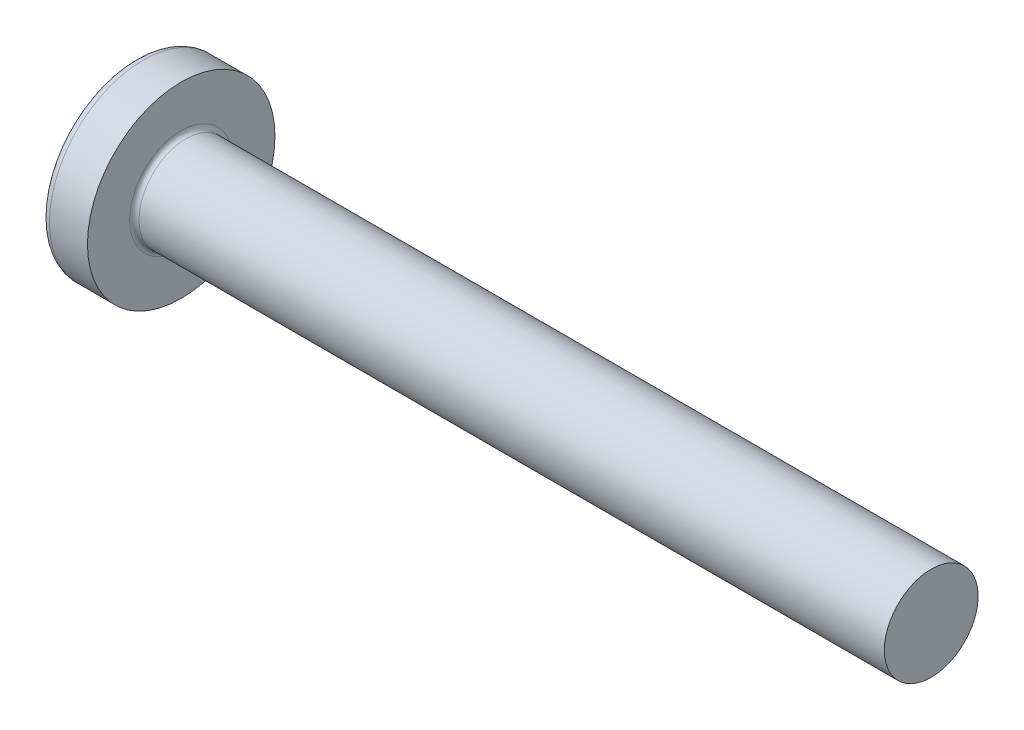
from build123d import *

# Parameters (mm, degrees)
FILLET1_R    = 0.1
RECPAT_COUNT = 2
RECPAT_ANGLE = 90


with BuildPart() as part:
    # BodySke → Base-Revolve (revolve)
    with BuildSketch(Plane.XY, mode=Mode.PRIVATE) as base_revolve_sk:
        with BuildLine():
            Line((1.6, 1), (1.6, 2))
            Line((1.6, 2), (0.790020747, 2))
            ThreePointArc((0.790020747, 2), (0.709789294, 1.981130115), (0.646379599, 1.928476821))
            ThreePointArc((0.646379599, 1.928476821), (0.165895084, 1.016959861), (0, 0))
            Line((0, 0), (17.6, 0))
            Line((17.6, 0), (17.6, 1))
            Line((17.6, 1), (1.6, 1))
        make_face()
    revolve(base_revolve_sk.sketch.rotate(Axis((0.790020747, 0, 0), (1, 0, 0)), 90), axis=Axis((0.790020747, 0, 0), (1, 0, 0)))

    # Fillet1
    fillet1_edges = [part.edges().sort_by_distance(p)[0] for p in [
        (1.6, 0, -1),
    ]]
    fillet(fillet1_edges, radius=FILLET1_R)

    # Sketch3 → Recess section 0
    with BuildSketch(Plane(origin=(0, 0, 0), x_dir=(0, 0, -1), z_dir=(1, 0, 0))):
        with BuildLine():
            Line((0.24, -1.05), (-0.24, -1.05))
            Line((-0.24, -1.05), (-0.24, 1.05))
            Line((-0.24, 1.05), (0.24, 1.05))
            Line((0.24, 1.05), (0.24, -1.05))
        make_face()
    # Sketch4 → Recess section 1
    with BuildSketch(Plane(origin=(1.42, 0, 0), x_dir=(0, 0, -1), z_dir=(1, 0, 0))):
        with BuildLine():
            Line((0.24, -0.342014235), (-0.24, -0.342014235))
            Line((-0.24, -0.342014235), (-0.24, 0.342014235))
            Line((-0.24, 0.342014235), (0.24, 0.342014235))
            Line((0.24, 0.342014235), (0.24, -0.342014235))
        make_face()
    recess = loft(mode=Mode.SUBTRACT)

    # RecPat: Recess ×2 about axis
    recpat_axis = Axis((0, 0, 0), (1, 0, 0))
    for i in range(1, RECPAT_COUNT):
        add(recess.rotate(recpat_axis, i * RECPAT_ANGLE / (RECPAT_COUNT - 1)), mode=Mode.SUBTRACT)

    # RecCorSke → RecessCore (revolve, cut)
    with BuildSketch(Plane.XY, mode=Mode.PRIVATE) as recesscore_sk:
        Polygon((0, 0), (0, 0.454796073), (1.42, 0.3555), (1.535508952, 0), align=None)
    revolve(recesscore_sk.sketch.rotate(Axis((-3.175, 0, 0), (1, 0, 0)), 13.894577695), axis=Axis((-3.175, 0, 0), (1, 0, 0)), mode=Mode.SUBTRACT)


solid = part.part
